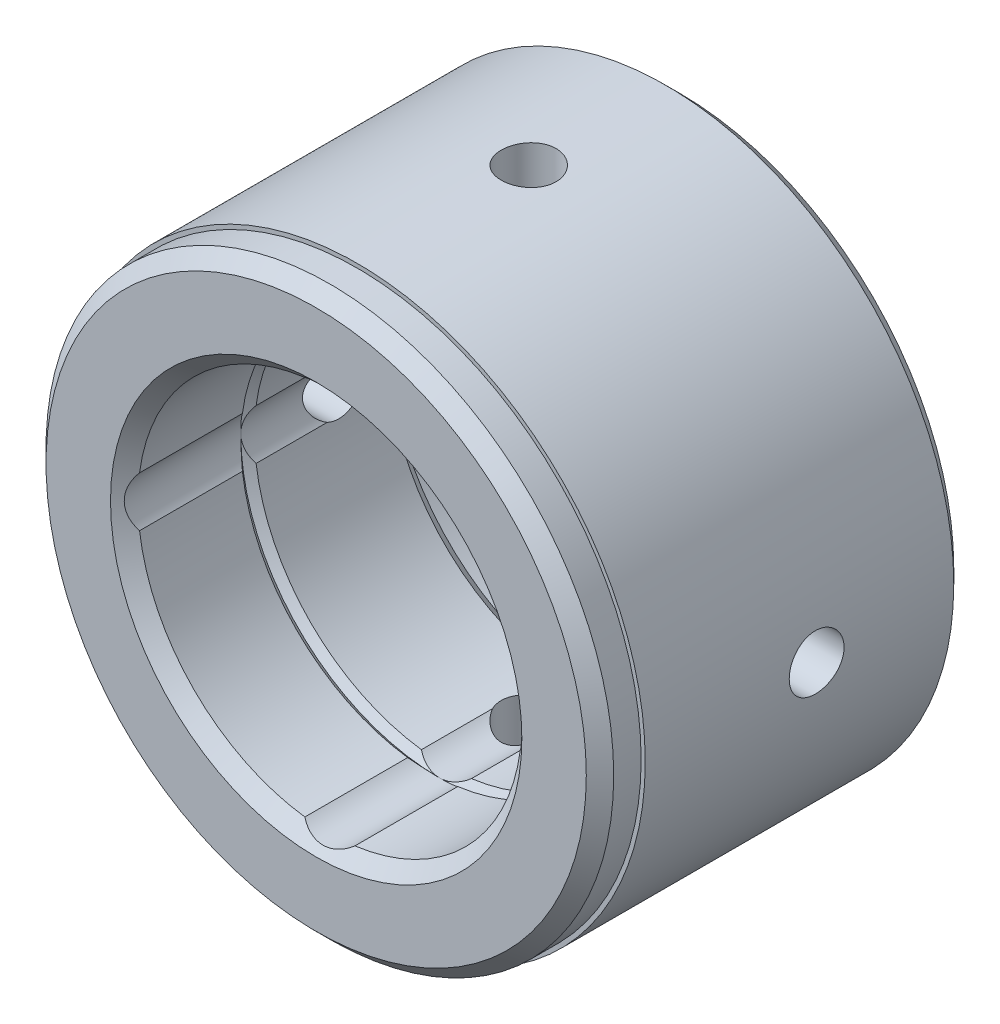
from build123d import *

# Parameters (mm, degrees)
SKETCH4_R          = 3
CUT_EXTRUDE1_DEPTH = 15.5
CIRPATTERN1_COUNT  = 4


with BuildPart() as part:
    # Sketch1 → Revolve1 (revolve)
    with BuildSketch(Plane(origin=(0, 0, 0), x_dir=(0, 0, -1), z_dir=(1, 0, 0)), mode=Mode.PRIVATE) as revolve1_sk:
        Polygon((3, 21), (25.5, 21), (26.5, 20), (26.5, 19), (25.5, 18), (20.3, 18), (20.3, 15), (19.3, 14), (9.5, 14), (9, 14.5), (8.5, 14), (1, 14), (0, 15), (0, 19.7), (1, 20.7), (3, 20.7), align=None)
    revolve(revolve1_sk.sketch.rotate(Axis((0, 0, 0), (0, 0, -1)), 90), axis=Axis((0, 0, 0), (0, 0, -1)))

    # Sketch2 → Ø4.0 (4) Diameter Hole1 (revolve, cut)
    with BuildSketch(Plane(origin=(0, 21, -15.5), x_dir=(0, 0, 1), z_dir=(1, 0, 0))):
        Polygon((0, 0), (0, 11.201721238), (2, 10), (2, 0), align=None)
    f_4_0_4_diameter_hole1 = revolve(axis=Axis((0, 27.35, -15.5), (0, -1, 0)), mode=Mode.SUBTRACT)

    # Sketch4 → Cut-Extrude1 (cut)
    with BuildSketch(Plane.XY):
        with Locations((0, 11.5)):
            Circle(SKETCH4_R)
    cut_extrude1 = extrude(amount=-CUT_EXTRUDE1_DEPTH, mode=Mode.SUBTRACT)

    # CirPattern1: Ø4.0 (4) Diameter Hole1, Cut-Extrude1 ×4 about axis
    cirpattern1_axis = Axis((0, 0, 0), (0, 0, 1))
    add([f_4_0_4_diameter_hole1.rotate(cirpattern1_axis, i * 360 / CIRPATTERN1_COUNT) for i in range(1, CIRPATTERN1_COUNT)], mode=Mode.SUBTRACT)
    add([cut_extrude1.rotate(cirpattern1_axis, i * 360 / CIRPATTERN1_COUNT) for i in range(1, CIRPATTERN1_COUNT)], mode=Mode.SUBTRACT)


solid = part.part
